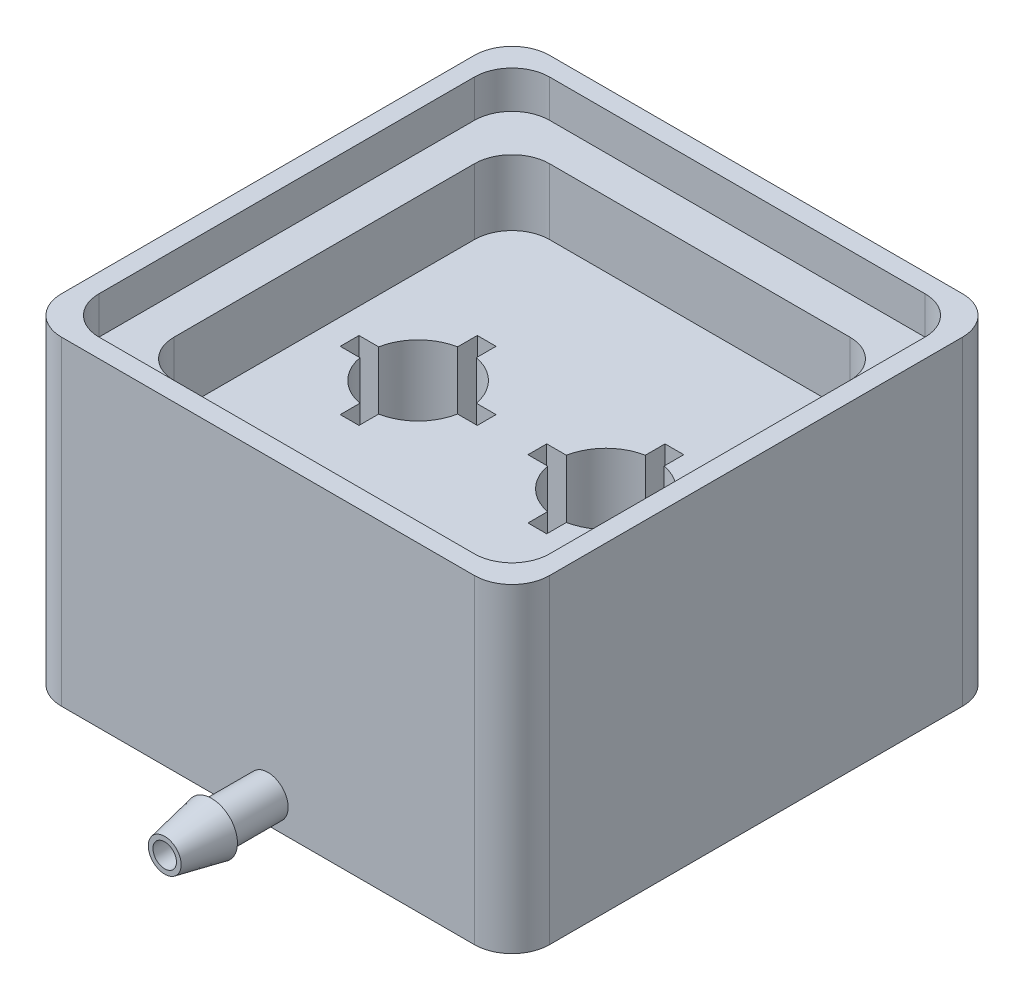
from build123d import *

# Parameters (mm, degrees)
SKETCH1_R                      = 2.65
BOSS_EXTRUDE1_DEPTH            = 11.53
CUT_EXTRUDE1_START             = -10.785
CUT_EXTRUDE1_DEPTH             = 10.785
CUT_EXTRUDE3_REACH             = 27.381
SKETCH10_R                     = 0.625
CUT_EXTRUDE3_DIRECTION_2_REACH = 27.381
CUT_EXTRUDE2_REACH             = 33.272
SKETCH5_R                      = 0.625
BOSS_EXTRUDE2_DEPTH            = 3.5
BOSS_EXTRUDE3_DEPTH            = 2


with BuildPart() as part:
    # Sketch1 → Boss-Extrude1 (new body)
    with BuildSketch(Plane(origin=(0, 0, 0), x_dir=(1, 0, 0), z_dir=(0, 1, 0))):
        with BuildLine():
            Line((-11, -13), (11, -13))
            ThreePointArc((11, -13), (12.414213562, -12.414213562), (13, -11))
            Line((13, -11), (13, 11))
            ThreePointArc((13, 11), (12.414213562, 12.414213562), (11, 13))
            Line((11, 13), (-11, 13))
            ThreePointArc((-11, 13), (-12.414213562, 12.414213562), (-13, 11))
            Line((-13, 11), (-13, -11))
            ThreePointArc((-13, -11), (-12.414213562, -12.414213562), (-11, -13))
        make_face()
        with Locations(Location((5, 0, 0), (0, 0, 270))):
            Circle(SKETCH1_R, mode=Mode.SUBTRACT)
        with Locations(Location((-5, 0, 0), (0, 0, 270))):
            Circle(SKETCH1_R, mode=Mode.SUBTRACT)
    extrude(amount=BOSS_EXTRUDE1_DEPTH)

    # Sketch2 → Cut-Extrude1 (cut)
    with BuildSketch(Plane(origin=(0, 11.53, 0), x_dir=(1, 0, 0), z_dir=(0, 1, 0)).offset(CUT_EXTRUDE1_START)):
        with BuildLine():
            Line((4.5, 3.65), (4.5, 2.602402736))
            ThreePointArc((4.5, 2.602402736), (5, 2.65), (5.5, 2.602402736))
            Line((5.5, 2.602402736), (5.5, 3.65))
            Line((5.5, 3.65), (4.5, 3.65))
        make_face()
        with BuildLine():
            ThreePointArc((7.65, 0), (7.638073848, -0.251130195), (7.602402736, -0.5))
            Line((7.602402736, -0.5), (8.65, -0.5))
            Line((8.65, -0.5), (8.65, 0.5))
            Line((8.65, 0.5), (7.602402736, 0.5))
            ThreePointArc((7.602402736, 0.5), (7.638073848, 0.251130195), (7.65, 0))
        make_face()
        with BuildLine():
            Line((4.5, -2.602402736), (4.5, -3.65))
            Line((4.5, -3.65), (5.5, -3.65))
            Line((5.5, -3.65), (5.5, -2.602402736))
            ThreePointArc((5.5, -2.602402736), (5, -2.65), (4.5, -2.602402736))
        make_face()
        with BuildLine():
            Line((1.35, -0.5), (2.397597264, -0.5))
            ThreePointArc((2.397597264, -0.5), (2.35, 0), (2.397597264, 0.5))
            Line((2.397597264, 0.5), (1.35, 0.5))
            Line((1.35, 0.5), (1.35, -0.5))
        make_face()
        with BuildLine():
            ThreePointArc((-2.35, 0), (-2.361926152, -0.251130195), (-2.397597264, -0.5))
            Line((-2.397597264, -0.5), (-1.35, -0.5))
            Line((-1.35, -0.5), (-1.35, 0.5))
            Line((-1.35, 0.5), (-2.397597264, 0.5))
            ThreePointArc((-2.397597264, 0.5), (-2.361926152, 0.251130195), (-2.35, 0))
        make_face()
        with BuildLine():
            Line((-5.5, 3.65), (-5.5, 2.602402736))
            ThreePointArc((-5.5, 2.602402736), (-5, 2.65), (-4.5, 2.602402736))
            Line((-4.5, 2.602402736), (-4.5, 3.65))
            Line((-4.5, 3.65), (-5.5, 3.65))
        make_face()
        with BuildLine():
            Line((-8.65, 0.5), (-8.65, -0.5))
            Line((-8.65, -0.5), (-7.602402736, -0.5))
            ThreePointArc((-7.602402736, -0.5), (-7.65, 0), (-7.602402736, 0.5))
            Line((-7.602402736, 0.5), (-8.65, 0.5))
        make_face()
        with BuildLine():
            ThreePointArc((-4.5, -2.602402736), (-5, -2.65), (-5.5, -2.602402736))
            Line((-5.5, -2.602402736), (-5.5, -3.65))
            Line((-5.5, -3.65), (-4.5, -3.65))
            Line((-4.5, -3.65), (-4.5, -2.602402736))
        make_face()
    extrude(amount=CUT_EXTRUDE1_DEPTH, mode=Mode.SUBTRACT)

    # Sketch3 → Revolve1 (revolve)
    with BuildSketch(Plane(origin=(0, 0, 0), x_dir=(0, 0, -1), z_dir=(1, 0, 0)), mode=Mode.PRIVATE) as revolve1_sk:
        Polygon((-13, 0.3), (-16, 0.3), (-16, 0), (-18.5, 0.5), (-18.5, 0.75), (-13, 0.75), align=None)
    revolve(revolve1_sk.sketch.rotate(Axis((0, 1.375, 13), (0, 0, 1)), 180), axis=Axis((0, 1.375, 13), (0, 0, 1)))

    # Sketch10 → Cut-Extrude3 (cut, up to next)
    with BuildSketch(Plane(origin=(0, 0, 0), x_dir=(0, 0, -1), z_dir=(1, 0, 0)), mode=Mode.PRIVATE) as cut_extrude3_sk1:
        with Locations(Location((0, 1.375, 0), (0, 0, 143.130102406))):
            Circle(SKETCH10_R)
    cut_extrude3_tool1 = extrude(cut_extrude3_sk1.sketch, amount=-CUT_EXTRUDE3_REACH, mode=Mode.PRIVATE) & part.part
    add(cut_extrude3_tool1.solids().sort_by_distance((0, 1.375, 0))[0], mode=Mode.SUBTRACT)

    # Sketch10 → Cut-Extrude3 direction 2 (cut, up to next)
    with BuildSketch(Plane(origin=(0, 0, 0), x_dir=(0, 0, -1), z_dir=(1, 0, 0)), mode=Mode.PRIVATE) as cut_extrude3_direction_2_sk1:
        with Locations(Location((0, 1.375, 0), (0, 0, 143.130102406))):
            Circle(SKETCH10_R)
    cut_extrude3_direction_2_tool1 = extrude(cut_extrude3_direction_2_sk1.sketch, amount=CUT_EXTRUDE3_DIRECTION_2_REACH, mode=Mode.PRIVATE) & part.part
    add(cut_extrude3_direction_2_tool1.solids().sort_by_distance((0, 1.375, 0))[0], mode=Mode.SUBTRACT)

    # Sketch5 → Cut-Extrude2 (cut, up to next)
    with BuildSketch(Plane.XY.offset(13), mode=Mode.PRIVATE) as cut_extrude2_sk1:
        with Locations(Location((0, 1.375, 0), (0, 0, 90))):
            Circle(SKETCH5_R)
    cut_extrude2_tool1 = extrude(cut_extrude2_sk1.sketch, amount=-CUT_EXTRUDE2_REACH, mode=Mode.PRIVATE) & part.part
    add(cut_extrude2_tool1.solids().sort_by_distance((0, 1.375, 13))[0], mode=Mode.SUBTRACT)

    # Sketch6 → Boss-Extrude2 (add)
    with BuildSketch(Plane(origin=(0, 11.53, 0), x_dir=(1, 0, 0), z_dir=(0, 1, 0))):
        with BuildLine():
            Line((-11, -13), (11, -13))
            ThreePointArc((11, -13), (12.414213562, -12.414213562), (13, -11))
            Line((13, -11), (13, 11))
            ThreePointArc((13, 11), (12.414213562, 12.414213562), (11, 13))
            Line((11, 13), (-11, 13))
            ThreePointArc((-11, 13), (-12.414213562, 12.414213562), (-13, 11))
            Line((-13, 11), (-13, -11))
            ThreePointArc((-13, -11), (-12.414213562, -12.414213562), (-11, -13))
        make_face()
        with BuildLine():
            Line((-8, -10), (8, -10))
            ThreePointArc((8, -10), (9.414213562, -9.414213562), (10, -8))
            Line((10, -8), (10, 8))
            ThreePointArc((10, 8), (9.414213562, 9.414213562), (8, 10))
            Line((8, 10), (-8, 10))
            ThreePointArc((-8, 10), (-9.414213562, 9.414213562), (-10, 8))
            Line((-10, 8), (-10, -8))
            ThreePointArc((-10, -8), (-9.414213562, -9.414213562), (-8, -10))
        make_face(mode=Mode.SUBTRACT)
    extrude(amount=BOSS_EXTRUDE2_DEPTH)

    # Sketch8 → Boss-Extrude3 (add)
    with BuildSketch(Plane(origin=(0, 15.03, 0), x_dir=(1, 0, 0), z_dir=(0, 1, 0))):
        with BuildLine():
            Line((-11, -13), (11, -13))
            ThreePointArc((11, -13), (12.414213562, -12.414213562), (13, -11))
            Line((13, -11), (13, 11))
            ThreePointArc((13, 11), (12.414213562, 12.414213562), (11, 13))
            Line((11, 13), (-11, 13))
            ThreePointArc((-11, 13), (-12.414213562, 12.414213562), (-13, 11))
            Line((-13, 11), (-13, -11))
            ThreePointArc((-13, -11), (-12.414213562, -12.414213562), (-11, -13))
        make_face()
        with BuildLine():
            Line((-10, -12), (10, -12))
            ThreePointArc((10, -12), (11.414213562, -11.414213562), (12, -10))
            Line((12, -10), (12, 10))
            ThreePointArc((12, 10), (11.414213562, 11.414213562), (10, 12))
            Line((10, 12), (-10, 12))
            ThreePointArc((-10, 12), (-11.414213562, 11.414213562), (-12, 10))
            Line((-12, 10), (-12, -10))
            ThreePointArc((-12, -10), (-11.414213562, -11.414213562), (-10, -12))
        make_face(mode=Mode.SUBTRACT)
    extrude(amount=BOSS_EXTRUDE3_DEPTH)


solid = part.part
